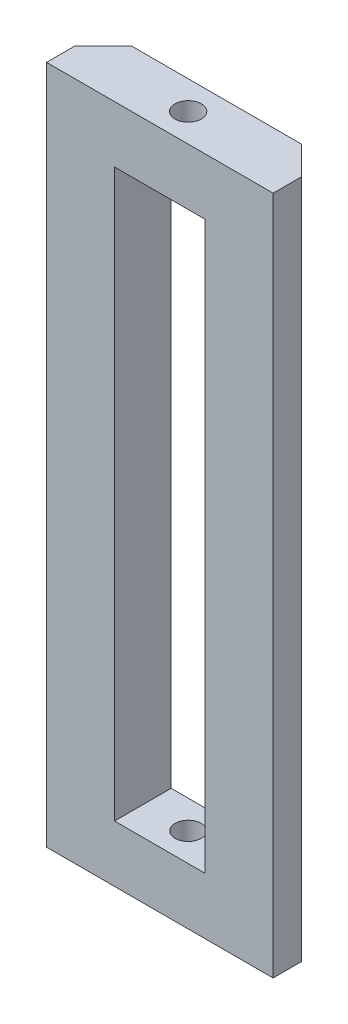
from build123d import *

# Parameters (mm, degrees)
SKETCH_1_W      = 40
SKETCH_1_H      = 10
SKETCH_1_R      = 2.3
EXTRUDE_1_DEPTH = 10
SKETCH_2_W      = 12
SKETCH_2_H      = 10
EXTRUDE_3_DEPTH = 100
SKETCH_3_W      = 40
SKETCH_3_H      = 10
SKETCH_3_R      = 2.329290182
EXTRUDE_4_DEPTH = 10
CHAMFER_1_SIZE  = 5


with BuildPart() as part:
    # Эскиз1 → Бобышка-Вытянуть1 (new body)
    with BuildSketch(Plane(origin=(0, 116.195974268, 0), x_dir=(1, 0, 0), z_dir=(0, 1, 0))):
        with Locations((64.808980694, -43.273129836)):
            Rectangle(SKETCH_1_W, SKETCH_1_H)
        with Locations(Location((64.808980694, -43.273129836, 0), (0, 0, 180))):
            Circle(SKETCH_1_R, mode=Mode.SUBTRACT)
    extrude(amount=EXTRUDE_1_DEPTH)

    # Эскиз2 → Бобышка-Вытянуть3 (add)
    with BuildSketch(Plane(origin=(0, 126.195974268, 0), x_dir=(1, 0, 0), z_dir=(0, 1, 0))):
        with Locations((50.808980694, -43.273129836)):
            Rectangle(SKETCH_2_W, SKETCH_2_H)
        with Locations((78.808980694, -43.273129836)):
            Rectangle(SKETCH_2_W, SKETCH_2_H)
    extrude(amount=EXTRUDE_3_DEPTH)

    # Эскиз3 → Бобышка-Вытянуть4 (add)
    with BuildSketch(Plane(origin=(0, 226.195974268, 0), x_dir=(1, 0, 0), z_dir=(0, 1, 0))):
        with Locations((64.808980694, -43.273129836)):
            Rectangle(SKETCH_3_W, SKETCH_3_H)
        with Locations(Location((64.808980694, -43.273129836, 0), (0, 0, 180))):
            Circle(SKETCH_3_R, mode=Mode.SUBTRACT)
    extrude(amount=EXTRUDE_4_DEPTH)

    # Фаска1
    chamfer_1_edges = [part.edges().sort_by_distance(p)[0] for p in [
        (44.808980694, 176.195974268, 38.273129836),
        (84.808980694, 176.195974268, 38.273129836),
    ]]
    chamfer(chamfer_1_edges, length=CHAMFER_1_SIZE)


solid = part.part
